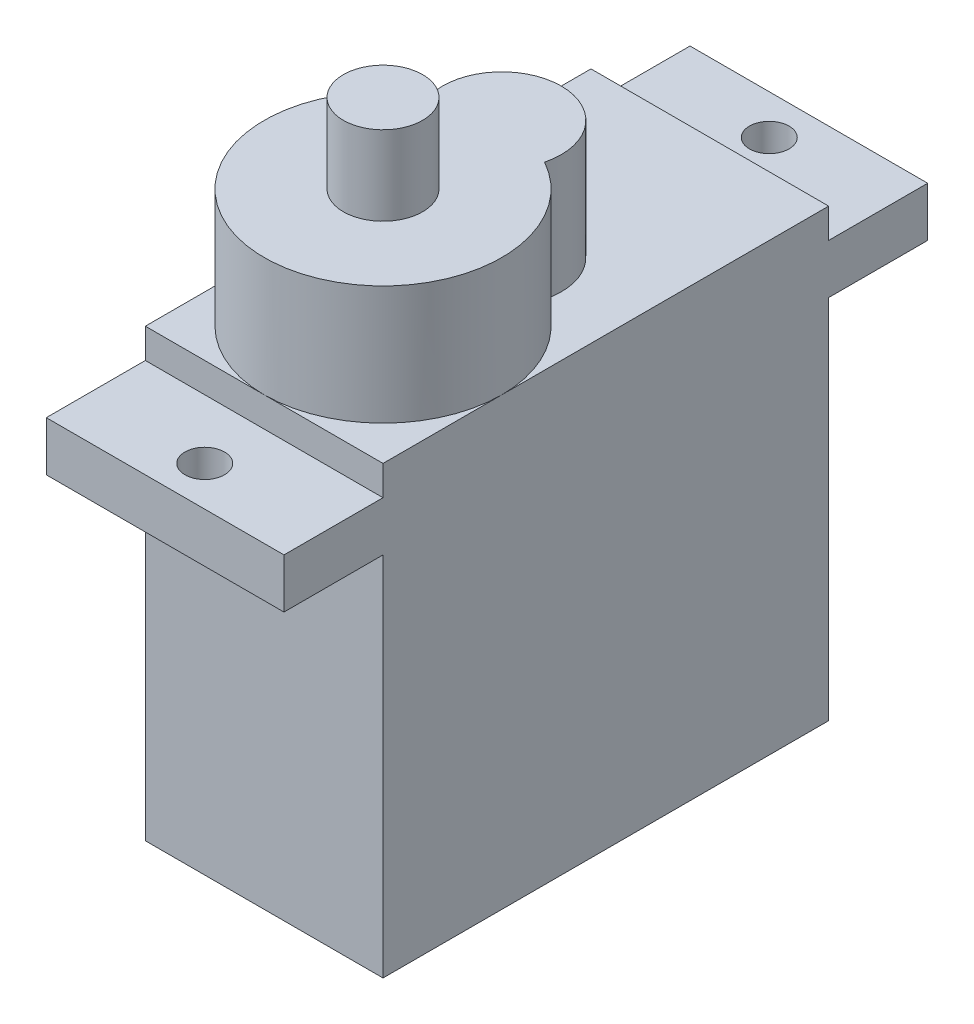
from build123d import *

# Parameters (mm, degrees)
EXTRUDE_1_DEPTH     = 12
EXTRUDE_2_DEPTH     = 6
SKETCH_3_R          = 2
EXTRUDE_3_DEPTH     = 4
SKETCH_4_R          = 1
CUT_EXTRUDE_1_DEPTH = 30.138677046


with BuildPart() as part:
    # 草圖1 → 填料-伸長1 (new body)
    with BuildSketch(Plane(origin=(0, 0, 0), x_dir=(0, 0, -1), z_dir=(1, 0, 0))):
        Polygon((11.25, 11.75), (16.25, 11.75), (16.25, 9.25), (11.25, 9.25), (11.25, -9.25), (-11.25, -9.25), (-11.25, 9.25), (-16.25, 9.25), (-16.25, 11.75), (-11.25, 11.75), (-11.25, 13.25), (11.25, 13.25), align=None)
    extrude(amount=EXTRUDE_1_DEPTH)

    # 草圖2 → 填料-伸長2 (add)
    with BuildSketch(Plane(origin=(0, 13.25, 0), x_dir=(1, 0, 0), z_dir=(0, 1, 0))):
        with BuildLine():
            ThreePointArc((3.09526249, 0), (6, -11.25), (8.90473751, 0))
            ThreePointArc((8.90473751, 0), (6, 3.75), (3.09526249, 0))
        make_face()
    extrude(amount=EXTRUDE_2_DEPTH)

    # 草圖3 → 填料-伸長3 (add)
    with BuildSketch(Plane(origin=(0, 19.25, 0), x_dir=(1, 0, 0), z_dir=(0, 1, 0))):
        with Locations(Location((6, -5.25, 0), (0, 0, 270))):
            Circle(SKETCH_3_R)
    extrude(amount=EXTRUDE_3_DEPTH)

    # 草圖4 → 除料-伸長1 (cut, through all)
    with BuildSketch(Plane(origin=(0, 11.75, 0), x_dir=(1, 0, 0), z_dir=(0, 1, 0))):
        with Locations(Location((6, -14.25, 0), (0, 0, 270))):
            Circle(SKETCH_4_R)
        with Locations(Location((6, 14.25, 0), (0, 0, 270))):
            Circle(SKETCH_4_R)
    extrude(amount=-CUT_EXTRUDE_1_DEPTH, mode=Mode.SUBTRACT)


solid = part.part
